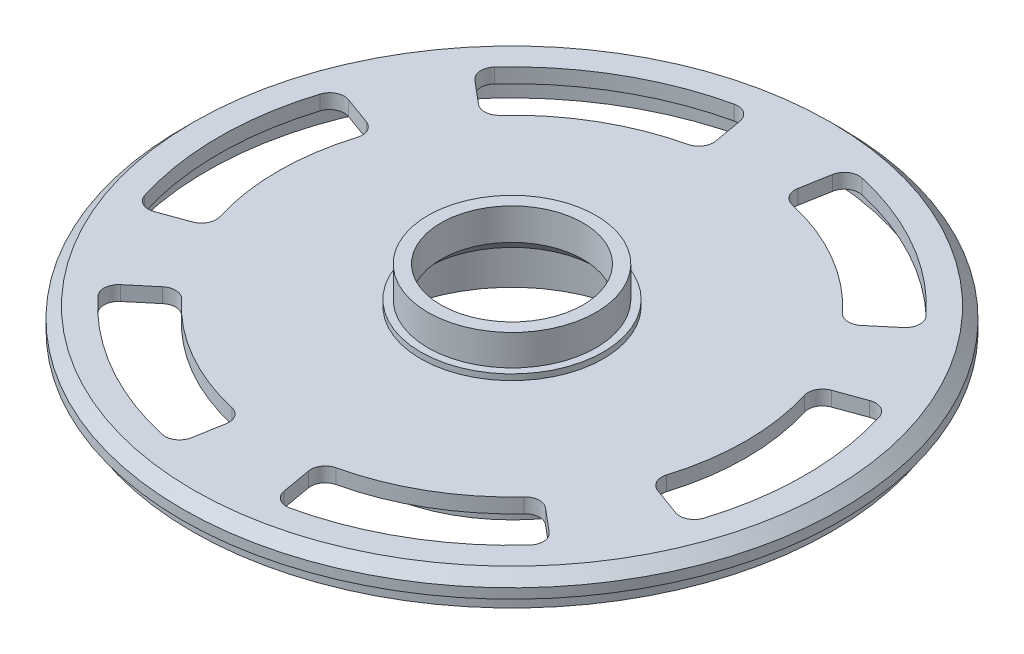
from build123d import *

# Parameters (mm, degrees)
CUT_EXTRUDE1_DEPTH      = 66.757280966
CIRPATTERN1_COUNT       = 6
CUT_EXTRUDE3_START      = 10
SKETCH4_R               = 2.06
CUT_EXTRUDE3_DEPTH      = 76.757280966
CIRPATTERN2_COUNT       = 42
SKETCH5_R               = 28.25
SKETCH5_R_2             = 25.75
CUT_EXTRUDE_THIN1_DEPTH = 2.5


with BuildPart() as part:
    # Sketch1 → Revolve1 (revolve)
    with BuildSketch(Plane.XY, mode=Mode.PRIVATE) as revolve1_sk:
        Polygon((-45.1, 8.15), (-43.75, 8.15), (-43.75, 6.15), (-41.75, 6.15), (-41.75, 9), (-30.5, 9), (-29.5, 7.5), (-24.5, 7.5), (-23.5, 9), (-20.5, 9), (-20.5, 0.15), (-18.5, 0.15), (-18.5, 8.15), (-17.75, 8.15), (-17.75, 9.65), (-11.75336247, 9.65), (-9.73, 11.67336247), (-9.73, 16), (-11.5, 16), (-11.5, 11.8), (-12.5, 11.8), (-12.5, 11), (-43.6, 11), (-45.1, 9.5), align=None)
    revolve(revolve1_sk.sketch.rotate(Axis((0, 0, 0), (0, -1, 0)), 270), axis=Axis((0, 0, 0), (0, -1, 0)))

    # Sketch2 → Cut-Extrude1 (cut, symmetric)
    with BuildSketch(Plane(origin=(0, 0, 0), x_dir=(1, 0, 0), z_dir=(0, 1, 0))):
        with BuildLine():
            Line((35.669246782, 13.283267007), (31.812113332, 11.879385242))
            ThreePointArc((31.812113332, 11.879385242), (30.705470783, 10.8907609), (30.58461517, 9.411764706))
            ThreePointArc((30.58461517, 9.411764706), (32, 0), (30.58461517, -9.411764706))
            ThreePointArc((30.58461517, -9.411764706), (30.705470783, -10.8907609), (31.812113332, -11.879385242))
            Line((31.812113332, -11.879385242), (35.669246782, -13.283267007))
            ThreePointArc((35.669246782, -13.283267007), (37.239172304, -13.196981693), (38.261596101, -12.002510729))
            ThreePointArc((38.261596101, -12.002510729), (40.1, 0), (38.261596101, 12.002510729))
            ThreePointArc((38.261596101, 12.002510729), (37.239172304, 13.196981693), (35.669246782, 13.283267007))
        make_face()
    cut_extrude1 = extrude(amount=CUT_EXTRUDE1_DEPTH, both=True, mode=Mode.SUBTRACT)

    # CirPattern1: Cut-Extrude1 ×6 about axis
    cirpattern1_axis = Axis((0, 0, 0), (0, 1, 0))
    for i in range(1, CIRPATTERN1_COUNT):
        add(cut_extrude1.rotate(cirpattern1_axis, i * 360 / CIRPATTERN1_COUNT), mode=Mode.SUBTRACT)

    # Sketch4 → Cut-Extrude3 (cut, through all)
    with BuildSketch(Plane(origin=(0, 0, 0), x_dir=(1, 0, 0), z_dir=(0, 1, 0)).offset(CUT_EXTRUDE3_START)):
        with Locations(Location((27, 0, 0), (0, 0, 180))):
            Circle(SKETCH4_R)
    cut_extrude3 = extrude(amount=-CUT_EXTRUDE3_DEPTH, mode=Mode.SUBTRACT)

    # CirPattern2: Cut-Extrude3 ×42 about axis
    cirpattern2_axis = Axis((0, 0, 0), (0, 1, 0))
    for i in range(1, CIRPATTERN2_COUNT):
        add(cut_extrude3.rotate(cirpattern2_axis, i * 360 / CIRPATTERN2_COUNT), mode=Mode.SUBTRACT)

    # Sketch5 → Cut-Extrude-Thin1 (cut)
    with BuildSketch(Plane.XZ.offset(-7.5)):
        Circle(SKETCH5_R)
        Circle(SKETCH5_R_2, mode=Mode.SUBTRACT)
    extrude(amount=-CUT_EXTRUDE_THIN1_DEPTH, mode=Mode.SUBTRACT)


solid = part.part
